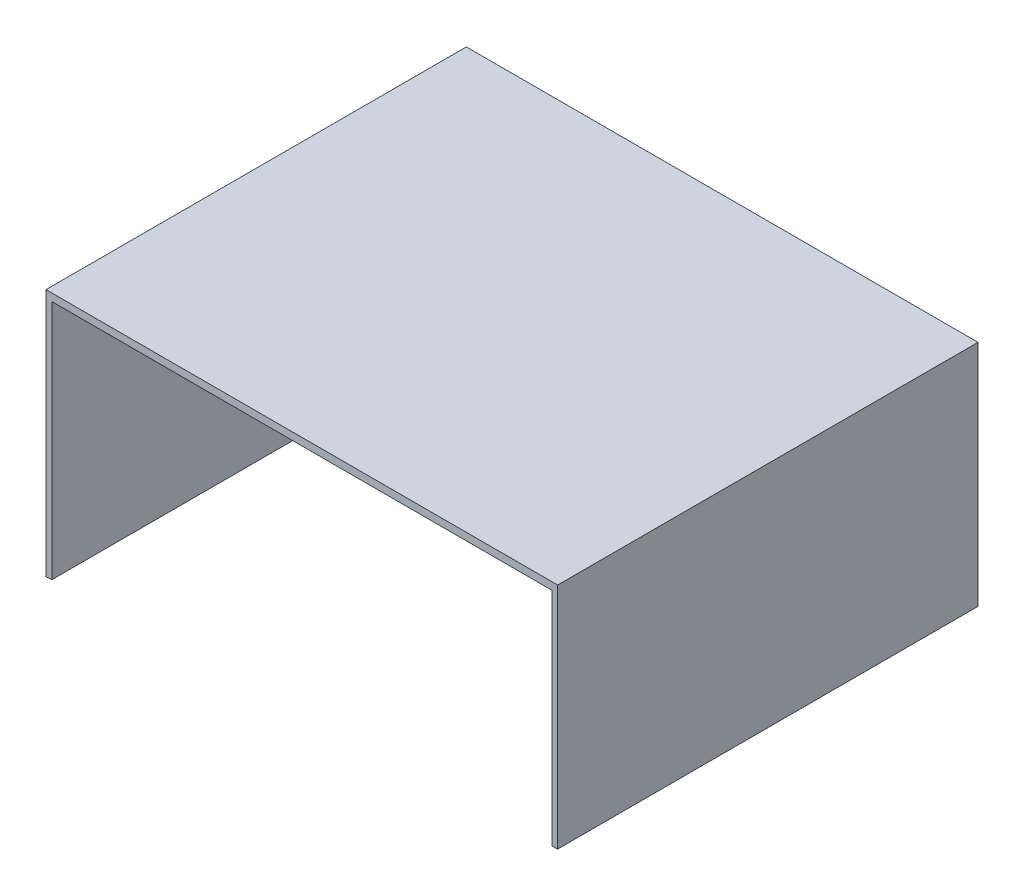
from build123d import *

# Parameters (mm, degrees)
BOSS_EXTRUDE1_DEPTH = 216.916


with BuildPart() as part:
    # Sketch1 → Boss-Extrude1 (new body)
    with BuildSketch(Plane.XY):
        Polygon((-65.860702475, -67.937929752), (-65.860702475, 60.352780543), (198.173606117, 60.352780543), (198.173606117, -57.654307352), (195.192248234, -57.770425439), (195.192248234, 56.521576525), (-62.879344592, 56.521576525), (-62.879344592, -67.821811665), align=None)
    extrude(amount=BOSS_EXTRUDE1_DEPTH)


solid = part.part
